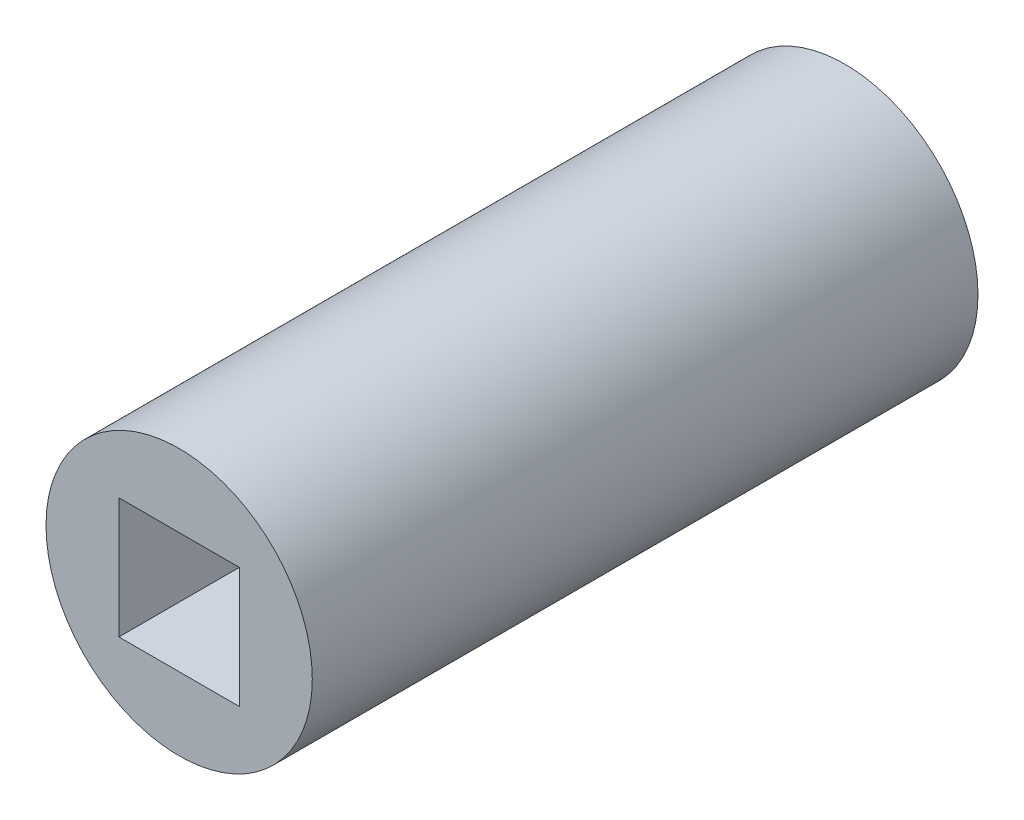
from build123d import *

# Parameters (mm, degrees)
BOSS_EXTRUDE1_DEPTH = 10
SKETCH2_R           = 3.5
BOSS_EXTRUDE2_DEPTH = 7.5
SKETCH3_W           = 3.16759605
SKETCH3_H           = 3.16756905
CUT_EXTRUDE1_DEPTH  = 5


with BuildPart() as part:
    # Sketch1 → Boss-Extrude1 (new body)
    with BuildSketch(Plane.XY):
        with BuildLine():
            ThreePointArc((-2.449489743, 2.5), (0, -3.5), (2.449489743, 2.5))
            ThreePointArc((2.449489743, 2.5), (0, 3.5), (-2.449489743, 2.5))
        make_face()
        with BuildLine():
            Line((-2, 1.5), (2, 1.5))
            ThreePointArc((2, 1.5), (0, -2.5), (-2, 1.5))
        make_face(mode=Mode.SUBTRACT)
    extrude(amount=BOSS_EXTRUDE1_DEPTH)

    # Sketch2 → Boss-Extrude2 (add)
    with BuildSketch(Plane.XY.offset(10)):
        Circle(SKETCH2_R)
    extrude(amount=BOSS_EXTRUDE2_DEPTH)

    # Sketch3 → Cut-Extrude1 (cut)
    with BuildSketch(Plane.XY.offset(17.5)):
        Rectangle(SKETCH3_W, SKETCH3_H)
    extrude(amount=-CUT_EXTRUDE1_DEPTH, mode=Mode.SUBTRACT)


solid = part.part
